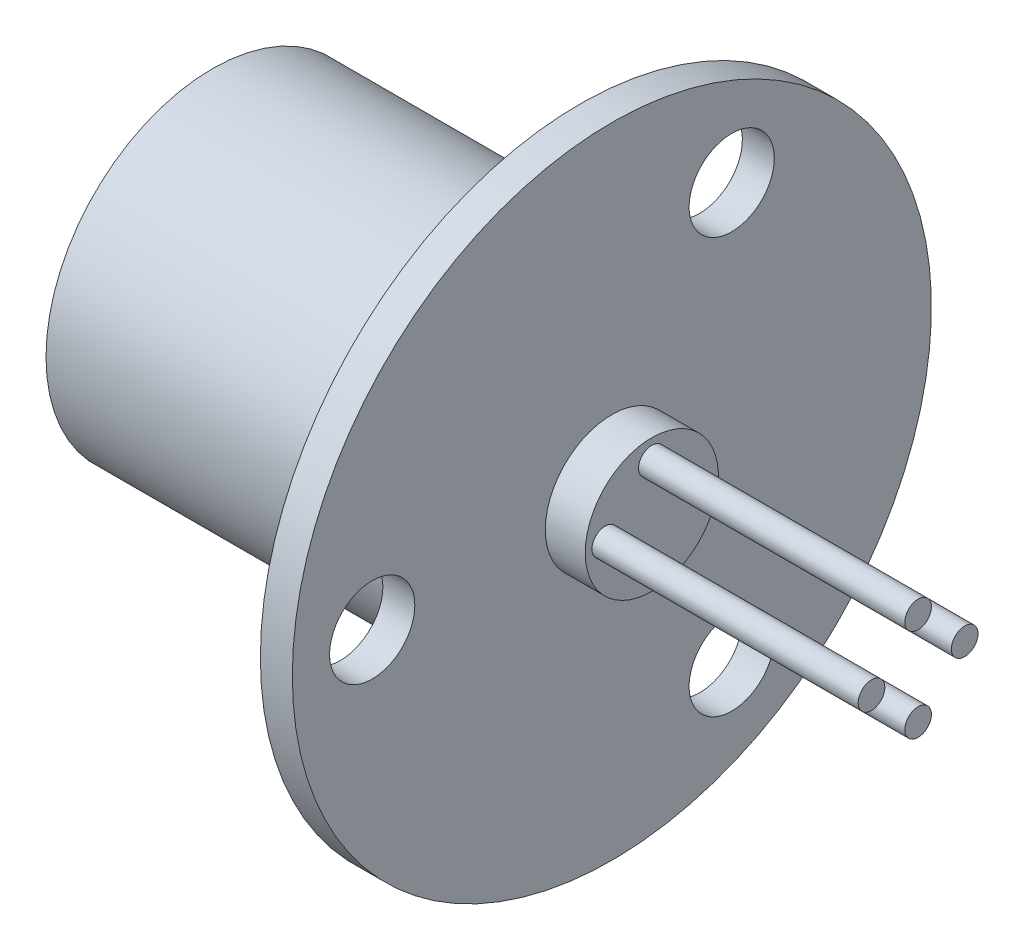
from build123d import *

# Parameters (mm, degrees)
CROQUIS1_W              = 13.8
CROQUIS1_H              = 6.25
CROQUIS1_W_2            = 1.5
CROQUIS1_H_2            = 2.5
CROQUIS2_R              = 1.6
CORTAR_EXTRUIR1_DEPTH   = 3.2
MATRIZC1_COUNT          = 3
CROQUIS3_R              = 0.5
SALIENTE_EXTRUIR1_DEPTH = 10
MATRIZC2_COUNT          = 4


with BuildPart() as part:
    # Croquis1 → Revolución1 (revolve)
    with BuildSketch(Plane(origin=(0, 0, 0), x_dir=(-1, 0, 0), z_dir=(0, 1, 0))):
        with Locations((-6.9, 3.125)):
            Rectangle(CROQUIS1_W, CROQUIS1_H)
        Polygon((-15, 0), (-13.8, 0), (-13.8, 6.25), (-13.8, 12), (-15, 12), (-15, 2.5), align=None)
        with Locations((-15.75, 1.25)):
            Rectangle(CROQUIS1_W_2, CROQUIS1_H_2)
    revolve(axis=Axis((0, 0, 0), (1, 0, 0)))

    # Croquis2 → Cortar-Extruir1 (cut)
    with BuildSketch(Plane.YZ.offset(15)):
        with Locations(Location((0, 9, 0), (0, 0, 270))):
            Circle(CROQUIS2_R)
    cortar_extruir1 = extrude(amount=-CORTAR_EXTRUIR1_DEPTH, mode=Mode.SUBTRACT)

    # MatrizC1: Cortar-Extruir1 ×3 about axis
    matrizc1_axis = Axis((0, 0, 0), (1, 0, 0))
    for i in range(1, MATRIZC1_COUNT):
        add(cortar_extruir1.rotate(matrizc1_axis, i * 360 / MATRIZC1_COUNT), mode=Mode.SUBTRACT)

    # Croquis3 → Saliente-Extruir1 (add)
    with BuildSketch(Plane.YZ.offset(16.5)):
        with Locations(Location((0, 1.75, 0), (0, 0, 270))):
            Circle(CROQUIS3_R)
    saliente_extruir1 = extrude(amount=SALIENTE_EXTRUIR1_DEPTH)

    # MatrizC2: Saliente-Extruir1 ×4 about axis
    matrizc2_axis = Axis((0, 0, 0), (1, 0, 0))
    for i in range(1, MATRIZC2_COUNT):
        add(saliente_extruir1.rotate(matrizc2_axis, i * 360 / MATRIZC2_COUNT))


solid = part.part
